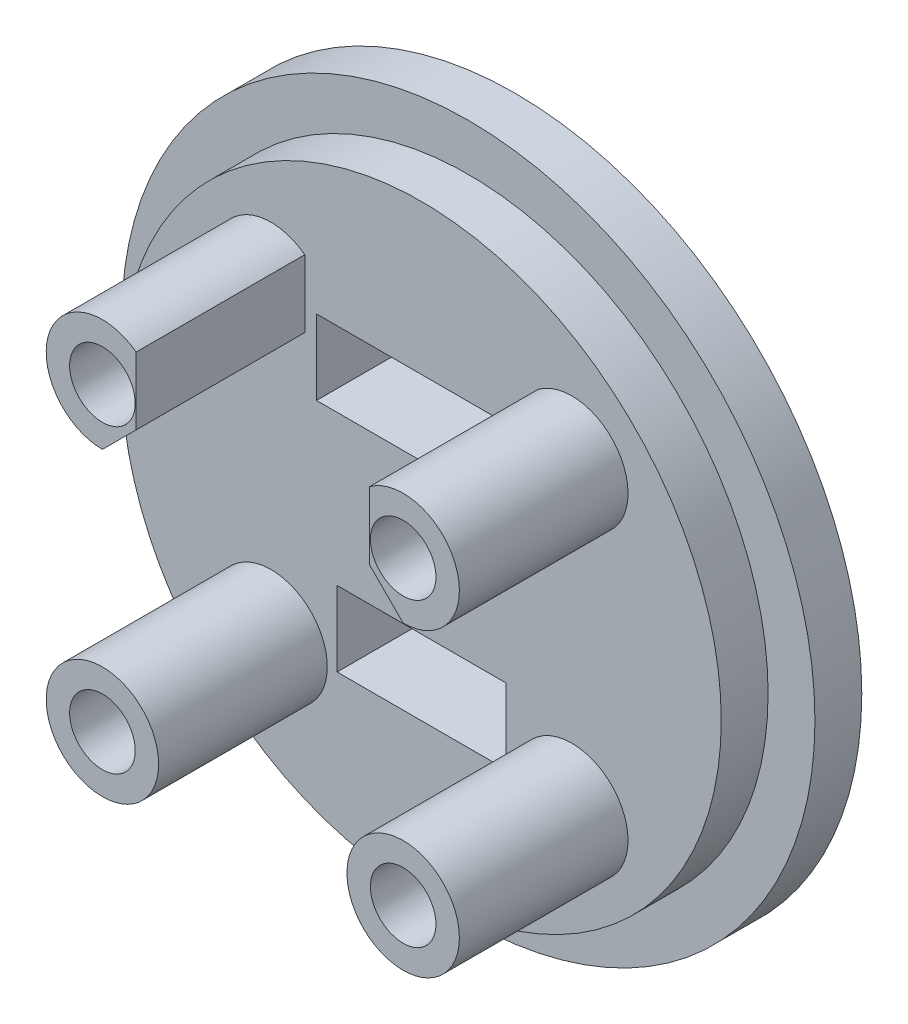
from build123d import *

# Parameters (mm, degrees)
CROQUIS1_R              = 16
SALIENTE_EXTRUIR1_DEPTH = 5
CROQUIS2_R              = 1.75
CORTAR_EXTRUIR1_DEPTH   = 24.173260453
CORTAR_EXTRUIR2_DEPTH   = 3
SALIENTE_EXTRUIR2_START = 9
CROQUIS4_R              = 3
CROQUIS4_R_2            = 1.75
SALIENTE_EXTRUIR2_DEPTH = 9
CORTAR_EXTRUIR3_DEPTH   = 9
CORTAR_EXTRUIR7_DEPTH   = 9
CROQUIS7_W              = 11.2
CROQUIS7_H              = 4
CROQUIS7_W_2            = 9
CORTAR_EXTRUIR8_DEPTH   = 25.351591324
CROQUIS8_R              = 18.5
CROQUIS8_R_2            = 16
SALIENTE_EXTRUIR3_DEPTH = 2.5


with BuildPart() as part:
    # Croquis1 → Saliente-Extruir1 (new body)
    with BuildSketch(Plane.XY):
        Circle(CROQUIS1_R)
    extrude(amount=SALIENTE_EXTRUIR1_DEPTH)

    # Croquis2 → Cortar-Extruir1 (cut, through all)
    with BuildSketch(Plane.XY.offset(5)):
        with Locations((-8.025, 8.025)):
            Circle(CROQUIS2_R)
        with Locations((8.025, 8.025)):
            Circle(CROQUIS2_R)
        with Locations((8.025, -8.025)):
            Circle(CROQUIS2_R)
        with Locations((-8.025, -8.025)):
            Circle(CROQUIS2_R)
    extrude(amount=-CORTAR_EXTRUIR1_DEPTH, mode=Mode.SUBTRACT)

    # Croquis3 → Cortar-Extruir2 (cut)
    with BuildSketch(Plane(origin=(0, 0, 0), x_dir=(-1, 0, 0), z_dir=(0, 0, -1))):
        Polygon((-4.560898385, 8.025), (-6.292949192, 11.025), (-9.757050808, 11.025), (-11.489101615, 8.025), (-9.757050808, 5.025), (-6.292949192, 5.025), align=None)
        Polygon((6.292949192, 5.025), (4.560898385, 8.025), (6.292949192, 11.025), (9.757050808, 11.025), (11.489101615, 8.025), (9.757050808, 5.025), align=None)
        Polygon((9.757050808, -5.025), (6.292949192, -5.025), (4.560898385, -8.025), (6.292949192, -11.025), (9.757050808, -11.025), (11.489101615, -8.025), align=None)
        Polygon((-6.292949192, -5.025), (-4.560898385, -8.025), (-6.292949192, -11.025), (-9.757050808, -11.025), (-11.489101615, -8.025), (-9.757050808, -5.025), align=None)
    extrude(amount=-CORTAR_EXTRUIR2_DEPTH, mode=Mode.SUBTRACT)

    # Croquis4 → Saliente-Extruir2 (add)
    # profile 1 of 4: a face of its own
    with BuildSketch(Plane.XY.offset(5).offset(SALIENTE_EXTRUIR2_START)):
        with Locations((-8.025, 8.025)):
            Circle(CROQUIS4_R)
        with Locations((-8.025, 8.025)):
            Circle(CROQUIS4_R_2, mode=Mode.SUBTRACT)
    # profile 2 of 4: a face of its own
    with BuildSketch(Plane.XY.offset(5).offset(SALIENTE_EXTRUIR2_START)):
        with Locations((8.025, 8.025)):
            Circle(CROQUIS4_R)
        with Locations((8.025, 8.025)):
            Circle(CROQUIS4_R_2, mode=Mode.SUBTRACT)
    # profile 3 of 4: a face of its own
    with BuildSketch(Plane.XY.offset(5).offset(SALIENTE_EXTRUIR2_START)):
        with Locations((-8.025, -8.025)):
            Circle(CROQUIS4_R)
        with Locations((-8.025, -8.025)):
            Circle(CROQUIS4_R_2, mode=Mode.SUBTRACT)
    # profile 4 of 4: a face of its own
    with BuildSketch(Plane.XY.offset(5).offset(SALIENTE_EXTRUIR2_START)):
        with Locations((8.025, -8.025)):
            Circle(CROQUIS4_R)
        with Locations((8.025, -8.025)):
            Circle(CROQUIS4_R_2, mode=Mode.SUBTRACT)
    extrude(amount=-SALIENTE_EXTRUIR2_DEPTH)

    # Croquis5 → Cortar-Extruir3 (cut)
    with BuildSketch(Plane.XY.offset(14)):
        with BuildLine():
            Line((-5.025, 8.025), (-8.025, 5.025))
            ThreePointArc((-8.025, 5.025), (-5.903679656, 5.903679656), (-5.025, 8.025))
        make_face()
        with BuildLine():
            Line((5.025, 8.025), (8.025, 5.025))
            ThreePointArc((8.025, 5.025), (5.903679656, 5.903679656), (5.025, 8.025))
        make_face()
    extrude(amount=-CORTAR_EXTRUIR3_DEPTH, mode=Mode.SUBTRACT)

    # Croquis6 → Cortar-Extruir7 (cut)
    with BuildSketch(Plane.XY.offset(14)):
        with BuildLine():
            Line((-6.22430322, 6.82569678), (-5.025, 8.025))
            ThreePointArc((-5.025, 8.025), (-5.341523678, 9.366251218), (-6.22430322, 10.424477257))
            Line((-6.22430322, 10.424477257), (-6.22430322, 6.82569678))
        make_face()
        with BuildLine():
            Line((6.22430322, 10.424477257), (6.22430322, 6.82569678))
            Line((6.22430322, 6.82569678), (5.025, 8.025))
            ThreePointArc((5.025, 8.025), (5.341523678, 9.366251218), (6.22430322, 10.424477257))
        make_face()
    extrude(amount=-CORTAR_EXTRUIR7_DEPTH, mode=Mode.SUBTRACT)

    # Croquis7 → Cortar-Extruir8 (cut, through all)
    with BuildSketch(Plane.XY.offset(5)):
        with Locations((0, 6)):
            Rectangle(CROQUIS7_W, CROQUIS7_H)
        with Locations((0, -6)):
            Rectangle(CROQUIS7_W_2, CROQUIS7_H)
    extrude(amount=-CORTAR_EXTRUIR8_DEPTH, mode=Mode.SUBTRACT)

    # Croquis8 → Saliente-Extruir3 (add)
    with BuildSketch(Plane(origin=(0, 0, 0), x_dir=(-1, 0, 0), z_dir=(0, 0, -1))):
        Circle(CROQUIS8_R)
        Circle(CROQUIS8_R_2, mode=Mode.SUBTRACT)
    extrude(amount=-SALIENTE_EXTRUIR3_DEPTH)


solid = part.part
